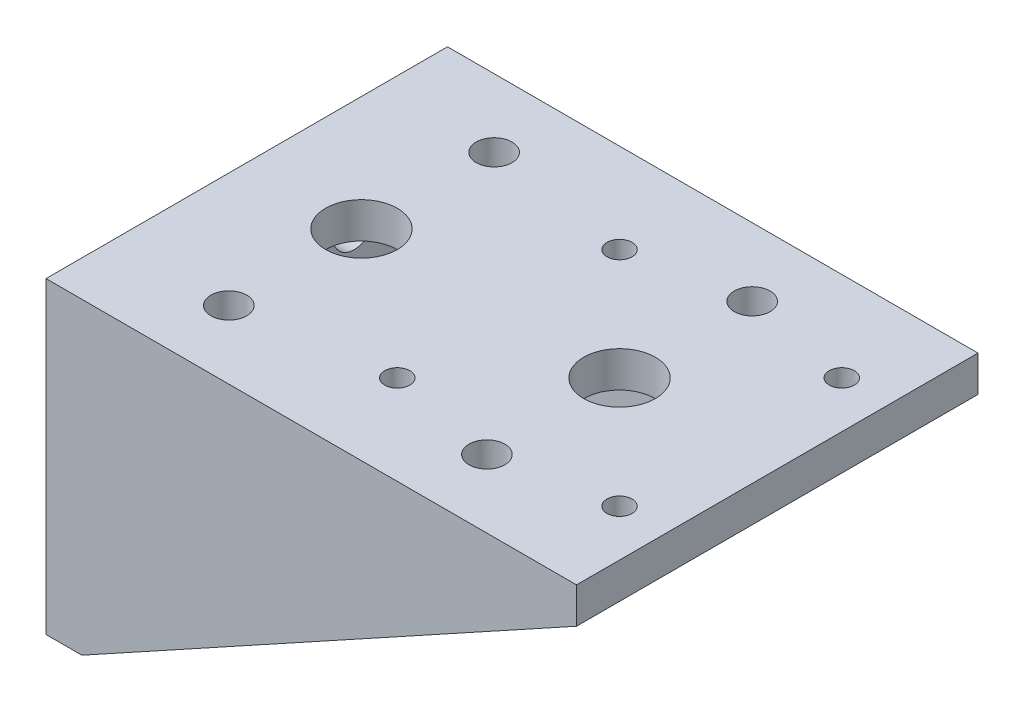
from build123d import *

# Parameters (mm, degrees)
SKETCH_1_W          = 74
SKETCH_1_H          = 56
SKETCH_1_R          = 2.5
SKETCH_1_R_2        = 5
SKETCH_1_R_3        = 1.75
EXTRUDE_1_DEPTH     = 5
EXTRUDE_2_DEPTH     = 38
CUT_EXTRUDE_1_REACH = 102.28
SKETCH_4_R          = 3
CUT_EXTRUDE_2_DEPTH = 5


with BuildPart() as part:
    # Эскиз1 → Бобышка-Вытянуть1 (new body)
    with BuildSketch(Plane(origin=(0, 0, 0), x_dir=(1, 0, 0), z_dir=(0, 1, 0))):
        with Locations((37, 28)):
            Rectangle(SKETCH_1_W, SKETCH_1_H)
        with Locations(Location((16, 46.5, 0), (0, 0, 270))):
            Circle(SKETCH_1_R, mode=Mode.SUBTRACT)
        with Locations(Location((16, 9.5, 0), (0, 0, 270))):
            Circle(SKETCH_1_R, mode=Mode.SUBTRACT)
        with Locations(Location((52, 46.5, 0), (0, 0, 270))):
            Circle(SKETCH_1_R, mode=Mode.SUBTRACT)
        with Locations(Location((52, 9.5, 0), (0, 0, 270))):
            Circle(SKETCH_1_R, mode=Mode.SUBTRACT)
        with Locations(Location((52, 28, 0), (0, 0, 270))):
            Circle(SKETCH_1_R_2, mode=Mode.SUBTRACT)
        with Locations(Location((67.5, 12.5, 0), (0, 0, 270))):
            Circle(SKETCH_1_R_3, mode=Mode.SUBTRACT)
        with Locations(Location((67.5, 43.5, 0), (0, 0, 270))):
            Circle(SKETCH_1_R_3, mode=Mode.SUBTRACT)
        with Locations(Location((36.5, 43.5, 0), (0, 0, 270))):
            Circle(SKETCH_1_R_3, mode=Mode.SUBTRACT)
        with Locations(Location((36.5, 12.5, 0), (0, 0, 270))):
            Circle(SKETCH_1_R_3, mode=Mode.SUBTRACT)
        with Locations(Location((16, 28, 0), (0, 0, 270))):
            Circle(SKETCH_1_R_2, mode=Mode.SUBTRACT)
    extrude(amount=EXTRUDE_1_DEPTH)

    # Эскиз2 → Бобышка-Вытянуть2 (add)
    with BuildSketch(Plane(origin=(0, 0, 0), x_dir=(-1, 0, 0), z_dir=(0, -1, 0))):
        Polygon((-74, 0), (0, 0), (0, 56), (-74, 56), (-74, 51), (-5, 51), (-5, 5), (-74, 5), align=None)
    extrude(amount=EXTRUDE_2_DEPTH)

    # Вырез-Вытянуть1: up to this face of the body (flat: up to its plane)
    cut_extrude_1_end = Plane(part.part.faces().sort_by_distance((37, -16.5, -56))[0])
    # Эскиз3 → Вырез-Вытянуть1 (cut, up to the picked face)
    with BuildSketch(Plane.XY, mode=Mode.PRIVATE) as cut_extrude_1_sk1:
        Polygon((5, -38), (74, 0), (74, -38), align=None)
    cut_extrude_1_tool1 = split(extrude(cut_extrude_1_sk1.sketch, amount=-CUT_EXTRUDE_1_REACH, mode=Mode.PRIVATE), bisect_by=cut_extrude_1_end, keep=Keep.BOTH, mode=Mode.PRIVATE)
    add(cut_extrude_1_tool1.solids().sort_by(Axis((51, -25.333333, 0), (0, 0, -1)))[0], mode=Mode.SUBTRACT)

    # Эскиз4 → Вырез-Вытянуть2 (cut)
    with BuildSketch(Plane.ZY):
        with Locations((-18, -25)):
            Circle(SKETCH_4_R)
        with Locations((-18, -5)):
            Circle(SKETCH_4_R)
        with Locations((-38, -5)):
            Circle(SKETCH_4_R)
        with Locations((-38, -25)):
            Circle(SKETCH_4_R)
    extrude(amount=-CUT_EXTRUDE_2_DEPTH, mode=Mode.SUBTRACT)


solid = part.part
